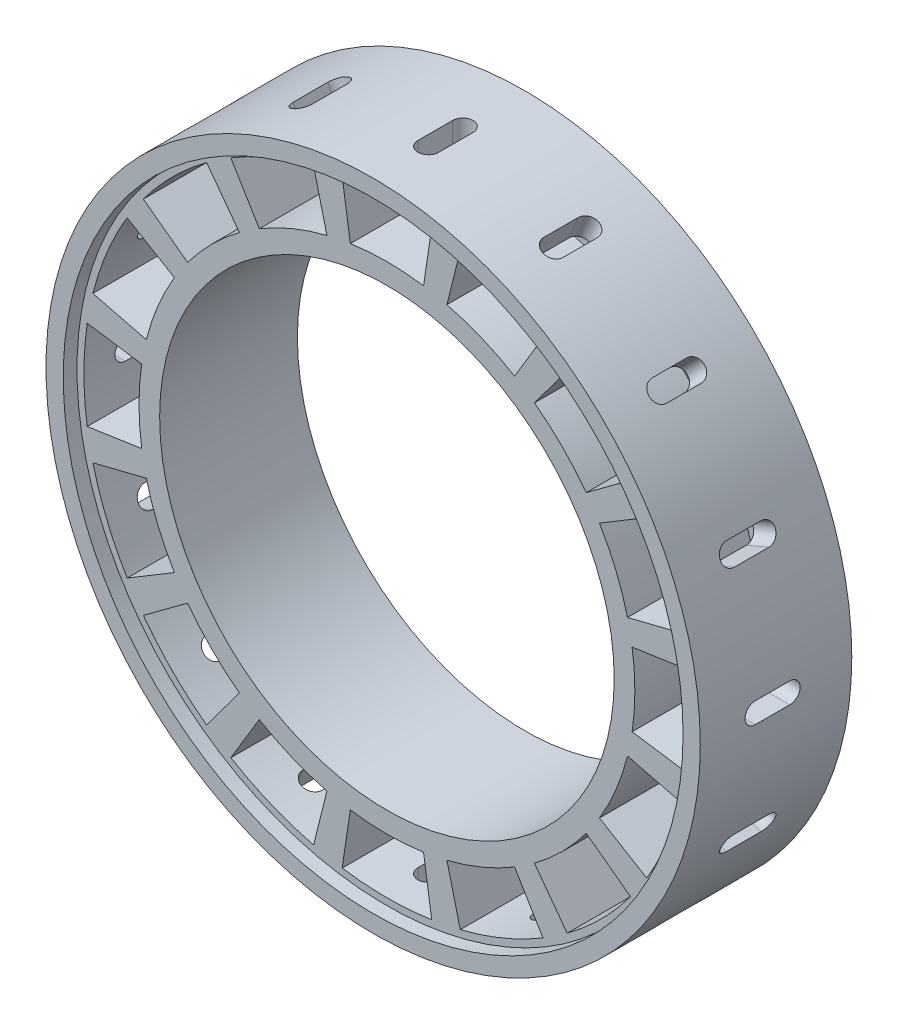
from build123d import *

# Parameters (mm, degrees)
SKETCH1_R           = 47.5
SKETCH1_R_2         = 33
BOSS_EXTRUDE1_DEPTH = 2
SKETCH2_R           = 47.5
SKETCH2_R_2         = 44
SKETCH2_R_3         = 36
SKETCH2_R_4         = 33
BOSS_EXTRUDE2_DEPTH = 18
CUT_EXTRUDE1_DEPTH  = 8
BOSS_EXTRUDE3_DEPTH = 18
CIRPATTERN1_COUNT   = 16
SKETCH5_R           = 47.5
SKETCH5_R_2         = 45
BOSS_EXTRUDE4_DEPTH = 2


with BuildPart() as part:
    # Sketch1 → Boss-Extrude1 (new body)
    with BuildSketch(Plane.XY):
        Circle(SKETCH1_R)
        Circle(SKETCH1_R_2, mode=Mode.SUBTRACT)
    extrude(amount=BOSS_EXTRUDE1_DEPTH)

    # Sketch2 → Boss-Extrude2 (add)
    # profile 1 of 2: a face of its own
    with BuildSketch(Plane.XY.offset(2)):
        Circle(SKETCH2_R)
        Circle(SKETCH2_R_2, mode=Mode.SUBTRACT)
    # profile 2 of 2: a face of its own
    with BuildSketch(Plane.XY.offset(2)):
        Circle(SKETCH2_R_3)
        Circle(SKETCH2_R_4, mode=Mode.SUBTRACT)
    extrude(amount=BOSS_EXTRUDE2_DEPTH)

    # Sketch3 → Cut-Extrude1 (cut)
    with BuildSketch(Plane(origin=(0, 47.5, 0), x_dir=(1, 0, 0), z_dir=(0, 1, 0))):
        with BuildLine():
            Line((1.5, -9), (1.5, -14))
            ThreePointArc((1.5, -14), (0, -15.5), (-1.5, -14))
            Line((-1.5, -14), (-1.5, -9))
            ThreePointArc((-1.5, -9), (0, -7.5), (1.5, -9))
        make_face()
    cut_extrude1 = extrude(amount=-CUT_EXTRUDE1_DEPTH, mode=Mode.SUBTRACT)

    # Sketch4 → Boss-Extrude3 (add)
    with BuildSketch(Plane.XY.offset(2)):
        with BuildLine():
            Line((-5.318181818, 35.605012879), (-6.5, 43.517237964))
            ThreePointArc((-6.5, 43.517237964), (-7.636921101, 43.332175529), (-8.768608238, 43.117415386))
            Line((-8.768608238, 43.117415386), (-7.174315831, 35.277885316))
            ThreePointArc((-7.174315831, 35.277885316), (-6.248389992, 35.45359816), (-5.318181818, 35.605012879))
        make_face()
        with BuildLine():
            Line((5.318181818, 35.605012879), (6.5, 43.517237964))
            ThreePointArc((6.5, 43.517237964), (7.636921101, 43.332175529), (8.768608238, 43.117415386))
            Line((8.768608238, 43.117415386), (7.174315831, 35.277885316))
            ThreePointArc((7.174315831, 35.277885316), (6.248389992, 35.45359816), (5.318181818, 35.605012879))
        make_face()
    boss_extrude3 = extrude(amount=BOSS_EXTRUDE3_DEPTH)

    # CirPattern1: Cut-Extrude1, Boss-Extrude3 ×16 about axis
    cirpattern1_axis = Axis((0, 0, 0), (0, 0, 1))
    add([cut_extrude1.rotate(cirpattern1_axis, i * 360 / CIRPATTERN1_COUNT) for i in range(1, CIRPATTERN1_COUNT)], mode=Mode.SUBTRACT)
    add([boss_extrude3.rotate(cirpattern1_axis, i * 360 / CIRPATTERN1_COUNT) for i in range(1, CIRPATTERN1_COUNT)])

    # Sketch5 → Boss-Extrude4 (add)
    with BuildSketch(Plane.XY.offset(20)):
        Circle(SKETCH5_R)
        Circle(SKETCH5_R_2, mode=Mode.SUBTRACT)
    extrude(amount=BOSS_EXTRUDE4_DEPTH)


solid = part.part
